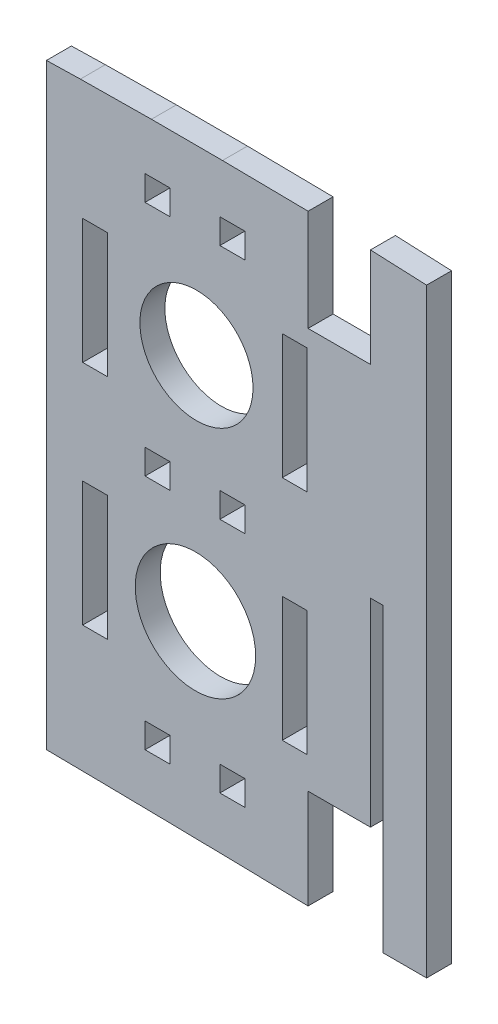
from build123d import *

# Parameters (mm, degrees)
MODEL_R         = 4.534410691
MODEL_R_2       = 4.826928656
MODEL_W         = 2
MODEL_H         = 10
MODEL_H_2       = 2
EXTRUDE_1_DEPTH = 2


with BuildPart() as part:
    # Model → 凸台-拉伸1 (new body)
    with BuildSketch(Plane.XY):
        Polygon((883.637204973, 587.330530622), (886.356553012, 587.393355998), (892.052378601, 587.452861056), (897.748434881, 587.438305688), (904.608822678, 587.348603606), (904.608822678, 579.211202345), (909.608822678, 579.211202345), (909.608822678, 580.211202345), (909.608822678, 587.161390594), (914.108822678, 586.966954635), (914.108822678, 579.859457913), (914.108822678, 538.869007346), (910.608822678, 538.869007346), (910.608822678, 562.993038329), (909.608822678, 562.993038329), (909.608822678, 547.086608467), (904.608822678, 547.086608467), (904.608822678, 539.117249216), (899.835523647, 539.223453365), (894.140406006, 539.331138315), (888.444075417, 539.420753158), (883.636881049, 539.481070293), (883.637204973, 541.525037946), align=None)
        with Locations((895.661921161, 572.865848158)):
            Circle(MODEL_R, mode=Mode.SUBTRACT)
        with Locations((895.579584436, 554.362843803)):
            Circle(MODEL_R_2, mode=Mode.SUBTRACT)
        with Locations((887.540358452, 554.584784532)):
            Rectangle(MODEL_W, MODEL_H, mode=Mode.SUBTRACT)
        with Locations((887.540358452, 572.817915241)):
            Rectangle(MODEL_W, MODEL_H, mode=Mode.SUBTRACT)
        with Locations((903.540358452, 572.817915241)):
            Rectangle(MODEL_W, MODEL_H, mode=Mode.SUBTRACT)
        with Locations((903.540358452, 554.584784532)):
            Rectangle(MODEL_W, MODEL_H, mode=Mode.SUBTRACT)
        with Locations((898.540358452, 544.428876798)):
            Rectangle(MODEL_W, MODEL_H_2, mode=Mode.SUBTRACT)
        with Locations((892.540358452, 544.428876798)):
            Rectangle(MODEL_W, MODEL_H_2, mode=Mode.SUBTRACT)
        with Locations((898.540358452, 563.428876798)):
            Rectangle(MODEL_W, MODEL_H_2, mode=Mode.SUBTRACT)
        with Locations((892.540358452, 563.428876798)):
            Rectangle(MODEL_W, MODEL_H_2, mode=Mode.SUBTRACT)
        with Locations((898.540358452, 582.428876798)):
            Rectangle(MODEL_W, MODEL_H_2, mode=Mode.SUBTRACT)
        with Locations((892.540358452, 582.428876798)):
            Rectangle(MODEL_W, MODEL_H_2, mode=Mode.SUBTRACT)
    extrude(amount=EXTRUDE_1_DEPTH)


solid = part.part
